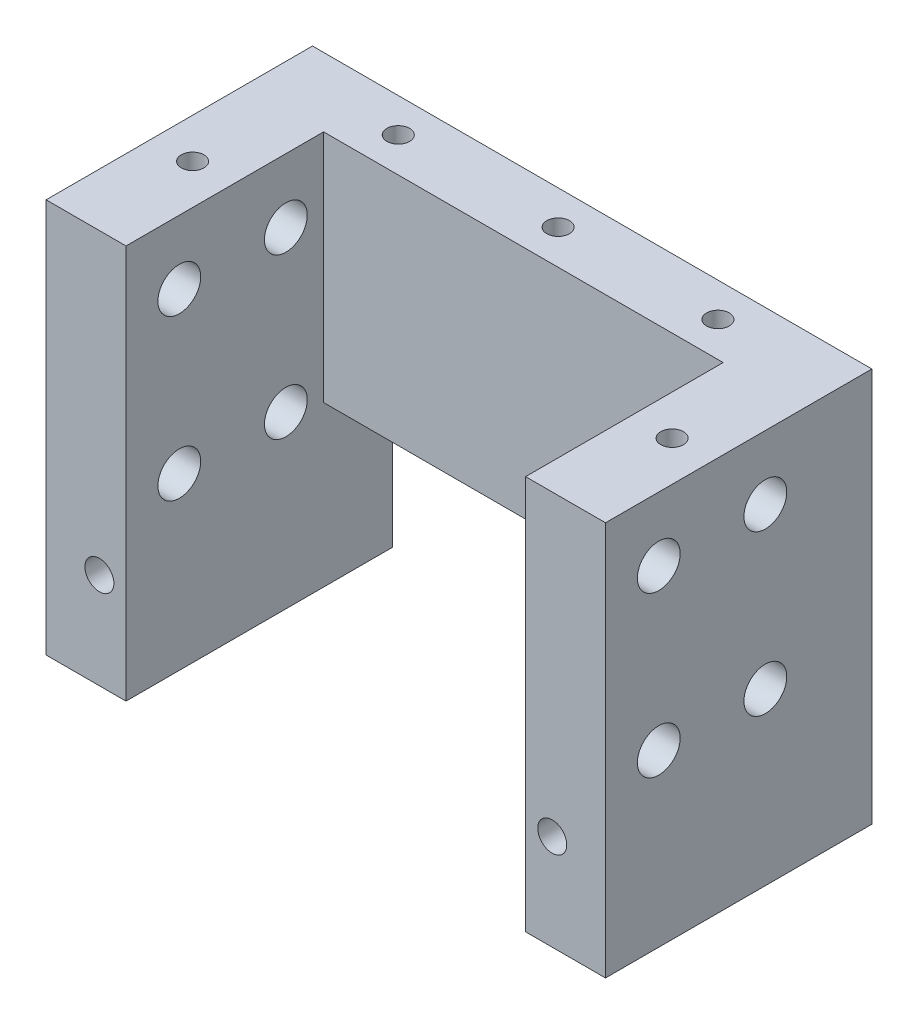
from build123d import *

# Parameters (mm, degrees)
SKETCH1_W                    = 66.675
SKETCH1_H                    = 31.75
BOSS_EXTRUDE1_DEPTH          = 23.495
CUT_EXTRUDE1_REACH           = 61.762
SKETCH2_W                    = 47.625
SKETCH2_H                    = 23.550328578
CUT_EXTRUDE2_REACH           = 53.686
SKETCH3_W                    = 47.625
SKETCH3_H                    = 19.05
F_1_4_20_TAPPED_HOLE1_REACH  = 74.454
F_1_4_20_TAPPED_HOLE1_BORE_R = 2.5527
F_8_32_TAPPED_HOLE1_D        = 3.4544
F_8_32_TAPPED_HOLE1_DEPTH    = 12.446
F_8_32_TAPPED_HOLE1_TIP      = 1.037806461
F_6_32_TAPPED_HOLE1_D        = 2.7051
F_6_32_TAPPED_HOLE1_DEPTH    = 13.716
F_6_32_TAPPED_HOLE1_TIP      = 0.81269403


with BuildPart() as part:
    # Sketch1 → Boss-Extrude1 (new, symmetric)
    with BuildSketch(Plane(origin=(0, 0, 0), x_dir=(1, 0, 0), z_dir=(0, 1, 0))):
        Rectangle(SKETCH1_W, SKETCH1_H)
    extrude(amount=BOSS_EXTRUDE1_DEPTH, both=True)

    # Sketch2 → Cut-Extrude1 (cut, up to next)
    with BuildSketch(Plane(origin=(0, 23.495, 0), x_dir=(1, 0, 0), z_dir=(0, 1, 0)), mode=Mode.PRIVATE) as cut_extrude1_sk1:
        with Locations((0, -4.099835711)):
            Rectangle(SKETCH2_W, SKETCH2_H)
    cut_extrude1_tool1 = extrude(cut_extrude1_sk1.sketch, amount=-CUT_EXTRUDE1_REACH, mode=Mode.PRIVATE) & part.part
    add(cut_extrude1_tool1.solids().sort_by_distance((0, 23.495, 4.099836))[0], mode=Mode.SUBTRACT)

    # Sketch3 → Cut-Extrude2 (cut, up to next)
    with BuildSketch(Plane(origin=(0, 0, -15.875), x_dir=(-1, 0, 0), z_dir=(0, 0, -1)), mode=Mode.PRIVATE) as cut_extrude2_sk1:
        with Locations((0, -13.97)):
            Rectangle(SKETCH3_W, SKETCH3_H)
    cut_extrude2_tool1 = extrude(cut_extrude2_sk1.sketch, amount=-CUT_EXTRUDE2_REACH, mode=Mode.PRIVATE) & part.part
    add(cut_extrude2_tool1.solids().sort_by_distance((0, -13.97, -15.875))[0], mode=Mode.SUBTRACT)

    # 1/4-20 Tapped Hole1 bore → 1/4-20 Tapped Hole1 (cut, up to next)
    with BuildSketch(Plane(origin=(33.3375, 0, 0), x_dir=(0, 0, -1), z_dir=(1, 0, 0)), mode=Mode.PRIVATE) as f_1_4_20_tapped_hole1_sk1:
        with Locations((-9.525, 15.875)):
            Circle(F_1_4_20_TAPPED_HOLE1_BORE_R)
    f_1_4_20_tapped_hole1_tool1 = extrude(f_1_4_20_tapped_hole1_sk1.sketch, amount=-F_1_4_20_TAPPED_HOLE1_REACH, mode=Mode.PRIVATE) & part.part
    # 1/4-20 Tapped Hole1 bore → 1/4-20 Tapped Hole1 (cut, up to next)
    with BuildSketch(Plane(origin=(33.3375, 0, 0), x_dir=(0, 0, -1), z_dir=(1, 0, 0)), mode=Mode.PRIVATE) as f_1_4_20_tapped_hole1_sk2:
        with Locations((3.175, 15.875)):
            Circle(F_1_4_20_TAPPED_HOLE1_BORE_R)
    f_1_4_20_tapped_hole1_tool2 = extrude(f_1_4_20_tapped_hole1_sk2.sketch, amount=-F_1_4_20_TAPPED_HOLE1_REACH, mode=Mode.PRIVATE) & part.part
    # 1/4-20 Tapped Hole1 bore → 1/4-20 Tapped Hole1 (cut, up to next)
    with BuildSketch(Plane(origin=(33.3375, 0, 0), x_dir=(0, 0, -1), z_dir=(1, 0, 0)), mode=Mode.PRIVATE) as f_1_4_20_tapped_hole1_sk3:
        with Locations((3.175, -3.175)):
            Circle(F_1_4_20_TAPPED_HOLE1_BORE_R)
    f_1_4_20_tapped_hole1_tool3 = extrude(f_1_4_20_tapped_hole1_sk3.sketch, amount=-F_1_4_20_TAPPED_HOLE1_REACH, mode=Mode.PRIVATE) & part.part
    # 1/4-20 Tapped Hole1 bore → 1/4-20 Tapped Hole1 (cut, up to next)
    with BuildSketch(Plane(origin=(33.3375, 0, 0), x_dir=(0, 0, -1), z_dir=(1, 0, 0)), mode=Mode.PRIVATE) as f_1_4_20_tapped_hole1_sk4:
        with Locations((-9.525, -3.175)):
            Circle(F_1_4_20_TAPPED_HOLE1_BORE_R)
    f_1_4_20_tapped_hole1_tool4 = extrude(f_1_4_20_tapped_hole1_sk4.sketch, amount=-F_1_4_20_TAPPED_HOLE1_REACH, mode=Mode.PRIVATE) & part.part
    f_1_4_20_tapped_hole1_1 = f_1_4_20_tapped_hole1_tool1.solids().sort_by_distance((33.3375, 15.875, 9.525))[0]
    add(f_1_4_20_tapped_hole1_1, mode=Mode.SUBTRACT)
    f_1_4_20_tapped_hole1_2 = f_1_4_20_tapped_hole1_tool2.solids().sort_by_distance((33.3375, 15.875, -3.175))[0]
    add(f_1_4_20_tapped_hole1_2, mode=Mode.SUBTRACT)
    f_1_4_20_tapped_hole1_3 = f_1_4_20_tapped_hole1_tool3.solids().sort_by_distance((33.3375, -3.175, -3.175))[0]
    add(f_1_4_20_tapped_hole1_3, mode=Mode.SUBTRACT)
    f_1_4_20_tapped_hole1_4 = f_1_4_20_tapped_hole1_tool4.solids().sort_by_distance((33.3375, -3.175, 9.525))[0]
    add(f_1_4_20_tapped_hole1_4, mode=Mode.SUBTRACT)
    f_1_4_20_tapped_hole1 = f_1_4_20_tapped_hole1_1 + f_1_4_20_tapped_hole1_2 + f_1_4_20_tapped_hole1_3 + f_1_4_20_tapped_hole1_4  # 1/4-20 Tapped Hole1 as one shape, for the pattern or mirror that repeats it

    # Mirror1: 1/4-20 Tapped Hole1 across plane
    add(f_1_4_20_tapped_hole1.mirror(Plane(origin=(0, 0, 0), x_dir=(0, 0, 1), z_dir=(1, 0, 0))), mode=Mode.SUBTRACT)

    # #8-32 Tapped Hole1
    with Locations(Plane.XY.offset(15.875)):
        with Locations((-26.9875, -12.065), (26.9875, -12.065)):
            Hole(F_8_32_TAPPED_HOLE1_D / 2, depth=F_8_32_TAPPED_HOLE1_DEPTH)
            with Locations((0, 0, -(F_8_32_TAPPED_HOLE1_DEPTH + F_8_32_TAPPED_HOLE1_TIP / 2))):  # 118° drill point
                Cone(0, F_8_32_TAPPED_HOLE1_D / 2, F_8_32_TAPPED_HOLE1_TIP, mode=Mode.SUBTRACT)

    # #6-32 Tapped Hole1
    with Locations(Plane(origin=(0, 23.495, 0), x_dir=(1, 0, 0), z_dir=(0, 1, 0))):
        with Locations((0, 11.811), (19.05, 11.811), (-19.05, 11.811), (-28.575, -3.175), (28.575, -3.175)):
            Hole(F_6_32_TAPPED_HOLE1_D / 2, depth=F_6_32_TAPPED_HOLE1_DEPTH)
            with Locations((0, 0, -(F_6_32_TAPPED_HOLE1_DEPTH + F_6_32_TAPPED_HOLE1_TIP / 2))):  # 118° drill point
                Cone(0, F_6_32_TAPPED_HOLE1_D / 2, F_6_32_TAPPED_HOLE1_TIP, mode=Mode.SUBTRACT)


solid = part.part
